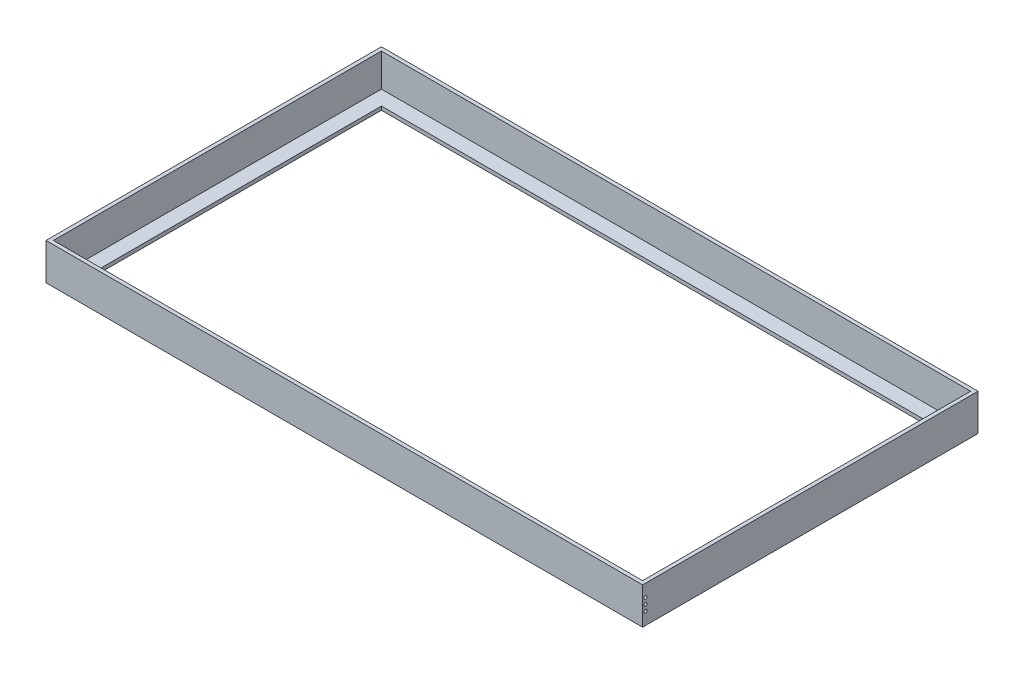
from build123d import *

# Parameters (mm, degrees)
SKETCH2_W           = 1626.4
SKETCH2_H           = 914.4
BOSS_EXTRUDE1_DEPTH = 100
SHELL1_T            = -10
SKETCH3_W           = 1526.4
SKETCH3_H           = 814.4
CUT_EXTRUDE1_DEPTH  = 1868.994732327
SKETCH5_R           = 4
CUT_EXTRUDE2_DEPTH  = 1869.503229861
SKETCH6_R           = 4
CUT_EXTRUDE3_DEPTH  = 1869.503229861
SKETCH7_R           = 4
CUT_EXTRUDE4_DEPTH  = 1869.503229861


with BuildPart() as part:
    # Sketch2 → Boss-Extrude1 (new body)
    with BuildSketch(Plane(origin=(0, 0, 0), x_dir=(1, 0, 0), z_dir=(0, 1, 0))):
        with Locations((813.2, 457.2)):
            Rectangle(SKETCH2_W, SKETCH2_H)
    extrude(amount=BOSS_EXTRUDE1_DEPTH)

    # Shell1
    shell1_openings = [part.faces().sort_by_distance(p)[0] for p in [
        (813.2, 100, -457.2),
    ]]
    offset(amount=SHELL1_T, openings=shell1_openings, kind=Kind.INTERSECTION)

    # Sketch3 → Cut-Extrude1 (cut, through all)
    with BuildSketch(Plane(origin=(0, 10, 0), x_dir=(1, 0, 0), z_dir=(0, 1, 0))):
        with Locations((813.2, 457.2)):
            Rectangle(SKETCH3_W, SKETCH3_H)
    extrude(amount=-CUT_EXTRUDE1_DEPTH, mode=Mode.SUBTRACT)

    # Sketch5 → Cut-Extrude2 (cut, through all)
    with BuildSketch(Plane(origin=(1626.4, 0, 0), x_dir=(0, 0, -1), z_dir=(1, 0, 0))):
        with Locations((7.85, 50)):
            Circle(SKETCH5_R)
    extrude(amount=-CUT_EXTRUDE2_DEPTH, mode=Mode.SUBTRACT)

    # Sketch6 → Cut-Extrude3 (cut, through all)
    with BuildSketch(Plane(origin=(1626.4, 0, 0), x_dir=(0, 0, -1), z_dir=(1, 0, 0))):
        with Locations((7.85, 66.28)):
            Circle(SKETCH6_R)
    extrude(amount=-CUT_EXTRUDE3_DEPTH, mode=Mode.SUBTRACT)

    # Sketch7 → Cut-Extrude4 (cut, through all)
    with BuildSketch(Plane(origin=(1626.4, 0, 0), x_dir=(0, 0, -1), z_dir=(1, 0, 0))):
        with Locations((7.85, 33.72)):
            Circle(SKETCH7_R)
    extrude(amount=-CUT_EXTRUDE4_DEPTH, mode=Mode.SUBTRACT)


solid = part.part
